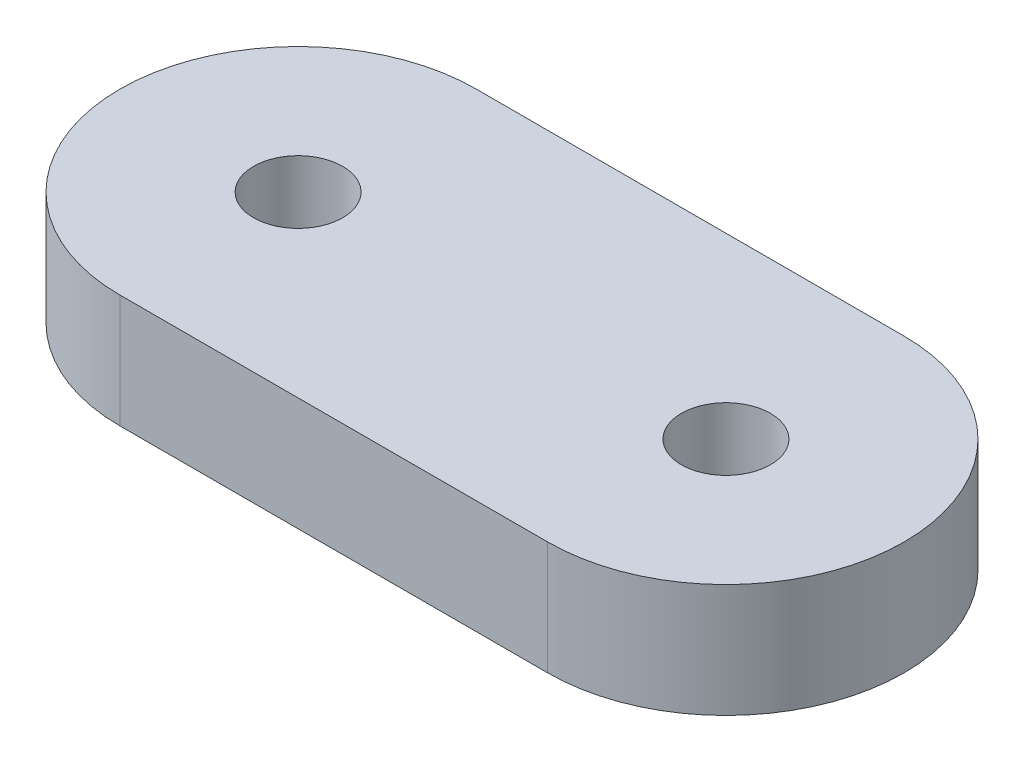
from build123d import *

# Parameters (mm, degrees)
SKETCH1_R           = 1.25
BOSS_EXTRUDE1_DEPTH = 3.18


with BuildPart() as part:
    # Sketch1 → Boss-Extrude1 (new body)
    with BuildSketch(Plane(origin=(0, 0, 0), x_dir=(1, 0, 0), z_dir=(0, 1, 0))):
        with BuildLine():
            Line((0, 5), (12, 5))
            ThreePointArc((12, 5), (17, 0), (12, -5))
            Line((12, -5), (0, -5))
            ThreePointArc((0, -5), (-5, 0), (0, 5))
        make_face()
        with Locations(Location((0, 0, 0), (0, 0, 90))):
            Circle(SKETCH1_R, mode=Mode.SUBTRACT)
        with Locations(Location((12, 0, 0), (0, 0, 90))):
            Circle(SKETCH1_R, mode=Mode.SUBTRACT)
    extrude(amount=BOSS_EXTRUDE1_DEPTH)


solid = part.part
